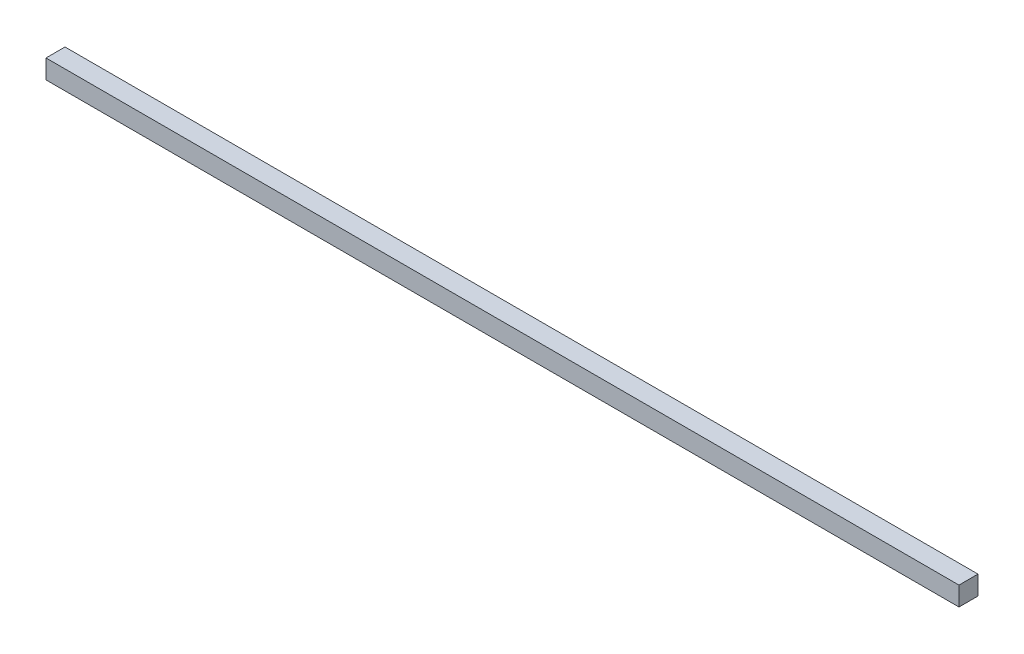
from build123d import *

# Parameters (mm, degrees)
SKETCH1_W           = 152.4
SKETCH1_H           = 3.175
BOSS_EXTRUDE1_DEPTH = 3.175


with BuildPart() as part:
    # Sketch1 → Boss-Extrude1 (new body)
    with BuildSketch(Plane(origin=(0, 0, 0), x_dir=(1, 0, 0), z_dir=(0, 1, 0))):
        with Locations((76.2, 1.5875)):
            Rectangle(SKETCH1_W, SKETCH1_H)
    extrude(amount=BOSS_EXTRUDE1_DEPTH)


solid = part.part
